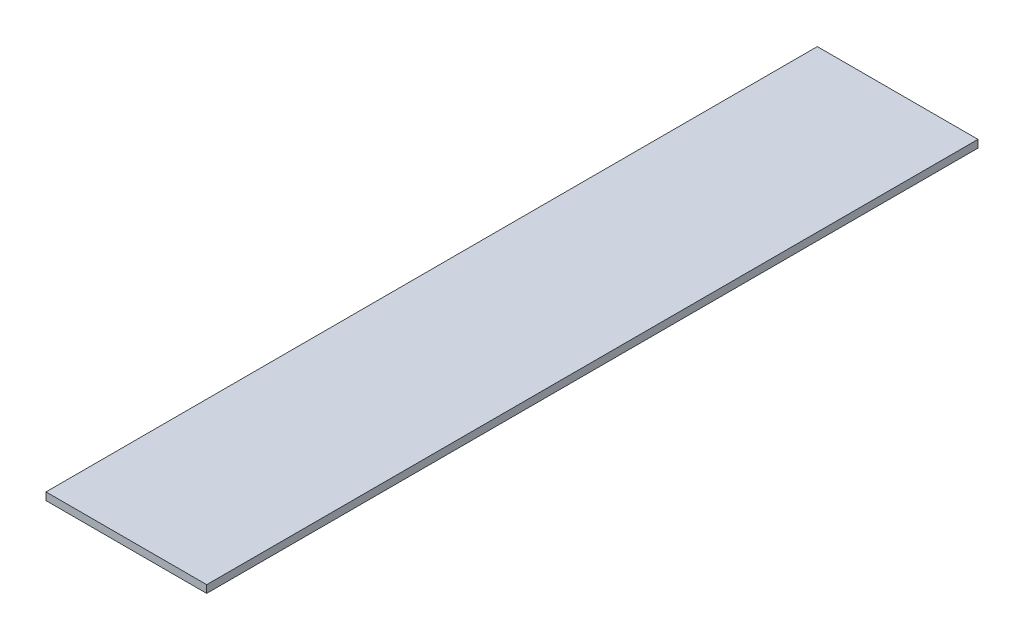
from build123d import *

# Parameters (mm, degrees)
SKETCH2_W           = 25
SKETCH2_H           = 120
BOSS_EXTRUDE1_DEPTH = 1.18


with BuildPart() as part:
    # Sketch2 → Boss-Extrude1 (new body)
    with BuildSketch(Plane(origin=(0, 0, 0), x_dir=(1, 0, 0), z_dir=(0, 1, 0))):
        Rectangle(SKETCH2_W, SKETCH2_H)
    extrude(amount=BOSS_EXTRUDE1_DEPTH)


solid = part.part
